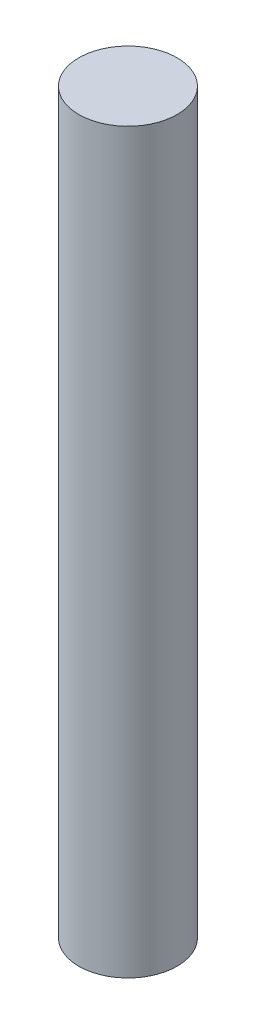
from build123d import *

# Parameters (mm, degrees)
SKETCH1_R           = 5
BOSS_EXTRUDE1_DEPTH = 75


with BuildPart() as part:
    # Sketch1 → Boss-Extrude1 (new body)
    with BuildSketch(Plane(origin=(0, 0, 0), x_dir=(1, 0, 0), z_dir=(0, 1, 0))):
        with Locations(Location((0, 0, 0), (0, 0, 270))):
            Circle(SKETCH1_R)
    extrude(amount=BOSS_EXTRUDE1_DEPTH)


solid = part.part
